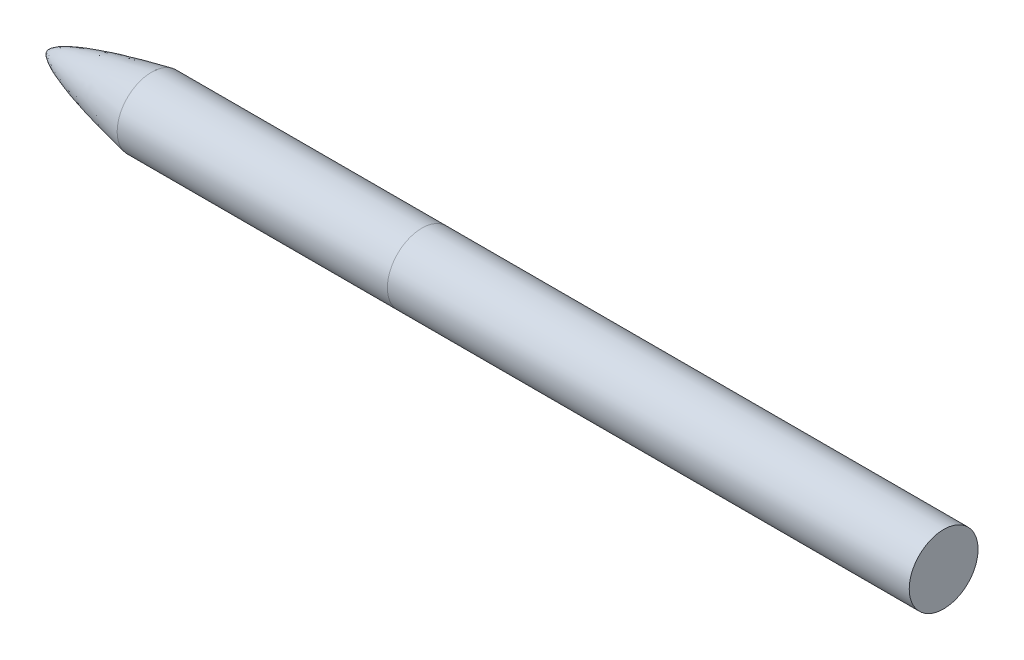
from build123d import *

# Parameters (mm, degrees)
SKETCH1_3_W = 68222.68985
SKETCH1_3_H = 4500


with BuildPart() as part:
    # Sketch1 → Revolve1 (revolve)
    with BuildSketch(Plane.XY):
        with BuildLine():
            Line((0, 4500), (-35326.359000001, 4500))
            add(Edge.make_bspline(
                [(-48976.359000001, 0), (-48976.3536378, 0.592613518), (-48976.3339196, 1.777539599), (-48976.277047319, 3.554033894), (-48976.151399279, 5.920773076), (-48975.988415082, 8.285190024), (-48975.792087569, 10.647010918), (-48975.50773179, 13.595797729), (-48974.975780644, 18.305938846), (-48974.075407048, 24.761855399), (-48972.812032318, 32.069732876), (-48971.267395832, 39.634127062), (-48969.406130221, 47.753458034), (-48966.826887694, 57.833836262), (-48963.067340728, 70.655981624), (-48958.380522807, 84.498372841), (-48953.283629347, 97.938184949), (-48948.457560841, 109.652853503), (-48944.057504252, 119.698224839), (-48937.677973068, 133.473896563), (-48929.005121031, 150.825042001), (-48916.705346911, 173.345494974), (-48900.17905621, 200.654871825), (-48873.413592917, 240.921000666), (-48829.808025233, 298.488708543), (-48773.833134371, 361.897558053), (-48705.088216994, 430.131142156), (-48627.566983367, 499.626495881), (-48547.260191937, 565.688964915), (-48447.593323125, 641.289222996), (-48327.616698758, 724.844021045), (-48177.570557011, 821.376913095), (-47996.222500301, 928.525753816), (-47813.160418479, 1028.366425653), (-47629.364126457, 1122.252913372), (-47427.759156545, 1220.226673609), (-47218.388687314, 1316.876243602), (-46980.583741622, 1420.976202747), (-46650.030870018, 1558.158722655), (-46262.64905038, 1709.47227868), (-45807.025701776, 1876.28468683), (-45282.513579632, 2056.162027147), (-44755.032819441, 2227.106590133), (-44291.397008234, 2370.055495571), (-43892.766446018, 2488.501040828), (-43559.854367942, 2584.740304492), (-43293.127973672, 2660.345077511), (-42959.262271221, 2753.220665068), (-42557.945851294, 2862.212651822), (-42088.860694681, 2986.079381315), (-41551.707674095, 3123.576838646), (-41080.885474721, 3240.660893911), (-40676.807854123, 3338.915051605), (-40339.759951046, 3419.477490421), (-40069.941755537, 3483.170074199), (-39799.952917419, 3546.13528461), (-39529.801971385, 3608.401189071), (-39259.49679673, 3669.994026644), (-38955.238190483, 3738.556465885), (-38684.622602168, 3798.771298134), (-38447.718246347, 3850.935880293), (-38244.578255187, 3895.286953096), (-38109.120643668, 3924.712178681), (-37973.632727933, 3953.997600057), (-37838.115178621, 3983.145493489), (-37702.56856844, 4012.158088334), (-37566.993578702, 4041.037527552), (-37431.390659342, 4069.785938185), (-37295.760591604, 4098.405321953), (-37160.103563896, 4126.897740566), (-37024.420694324, 4155.265016528), (-36888.711527556, 4183.509230396), (-36752.978156789, 4211.631907315), (-36617.218432374, 4239.635362255), (-36481.437199134, 4267.520478978), (-36345.627490888, 4295.290431501), (-36226.781140549, 4319.487518527), (-36124.886412175, 4340.15977132), (-36039.983925564, 4357.336343801), (-35972.022035334, 4371.056678839), (-35904.123942456, 4384.735782617), (-35836.097350561, 4398.411892791), (-35768.273380284, 4412.019711581), (-35700.097732824, 4425.669076765), (-35632.491220751, 4439.178043534), (-35563.919209135, 4452.850357712), (-35496.991795405, 4466.169925715), (-35435.741180669, 4478.332615947), (-35387.604221043, 4487.877737786), (-35349.729351611, 4495.376176609), (-35334.118254757, 4498.465202356), (-35326.359, 4500)],
                knots=[0, 0, 0, 0, 0, 0.000148328, 0.000296656, 0.000444984, 0.000593312, 0.00074164, 0.000889968, 0.001186624, 0.001779936, 0.002373248, 0.002746243, 0.003119238, 0.003865227, 0.004977849, 0.006090471, 0.006776811, 0.007463151, 0.008149491, 0.008835831, 0.01057717, 0.012318509, 0.014571621, 0.016824732, 0.022677932, 0.030383596, 0.035722001, 0.041060407, 0.048735074, 0.056409742, 0.067031743, 0.077653744, 0.093392406, 0.109131068, 0.119224979, 0.129318889, 0.14950671, 0.166858233, 0.184209755, 0.218912801, 0.253615851, 0.288318902, 0.323021951, 0.357725001, 0.375076528, 0.392428056, 0.409779583, 0.42713111, 0.461834163, 0.496537215, 0.531240268, 0.565943321, 0.583294848, 0.600646375, 0.617997901, 0.635349428, 0.652700955, 0.670052482, 0.687404009, 0.7134313, 0.722107063, 0.730782826, 0.73945859, 0.748134353, 0.756810117, 0.76548588, 0.774161643, 0.782837407, 0.79151317, 0.800188934, 0.808864697, 0.81754046, 0.826216224, 0.834891987, 0.84356775, 0.852243514, 0.860919277, 0.865257159, 0.86959504, 0.873932922, 0.878270803, 0.882608685, 0.886946567, 0.891284448, 0.89562233, 0.899960212, 0.904298093, 0.908635975, 0.910804916, 0.912973857, 0.912973857, 0.912973857, 0.912973857, 0.912973857], degree=4))
            Line((-48976.359000001, 0), (-35326.359, 0))
            Line((-35326.359, 0), (0, 0))
            Line((0, 0), (0, 4500))
        make_face()
    revolve(axis=Axis((-35326.359, 0, 0), (1, 0, 0)))


with BuildPart() as body_2:
    # Sketch1<3> → Revolve2 (revolve)
    with BuildSketch(Plane.XY):
        with Locations((34111.344925, 2250)):
            Rectangle(SKETCH1_3_W, SKETCH1_3_H)
    revolve(axis=Axis((0, 0, 0), (1, 0, 0)))


solid = Compound([part.part, body_2.part])
